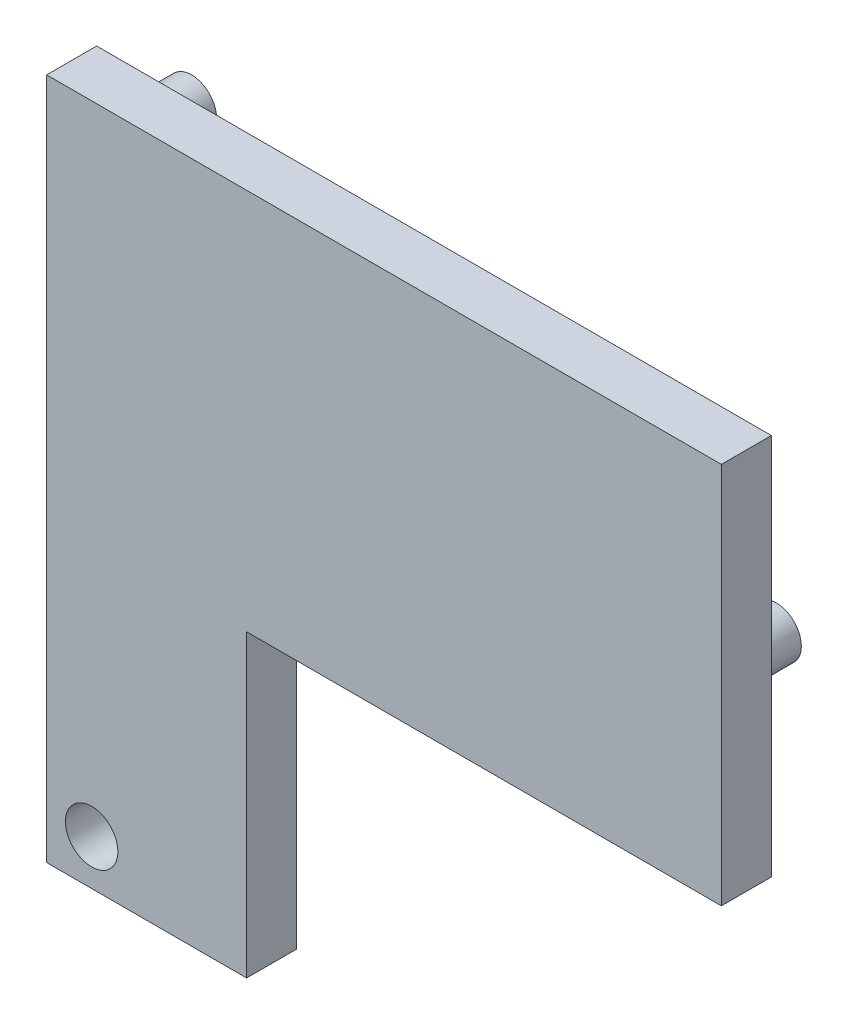
from build123d import *

# Parameters (mm, degrees)
SKETCH1_R           = 1.05
BOSS_EXTRUDE1_DEPTH = 2
SKETCH2_R           = 1
BOSS_EXTRUDE2_DEPTH = 4


with BuildPart() as part:
    # Sketch1 → Boss-Extrude1 (new body)
    with BuildSketch(Plane.XY):
        Polygon((-53.65, -57.3), (-45.65, -57.3), (-45.65, -45.3), (-26.65, -45.3), (-26.65, -30), (-53.65, -30), align=None)
        with Locations((-51.85, -55.5)):
            Circle(SKETCH1_R, mode=Mode.SUBTRACT)
    extrude(amount=BOSS_EXTRUDE1_DEPTH)

    # Sketch2 → Boss-Extrude2 (add)
    with BuildSketch(Plane.XY.offset(2)):
        with Locations((-28.45, -38.7)):
            Circle(SKETCH2_R)
        with Locations((-51.85, -32.1)):
            Circle(SKETCH2_R)
    extrude(amount=-BOSS_EXTRUDE2_DEPTH)


solid = part.part
